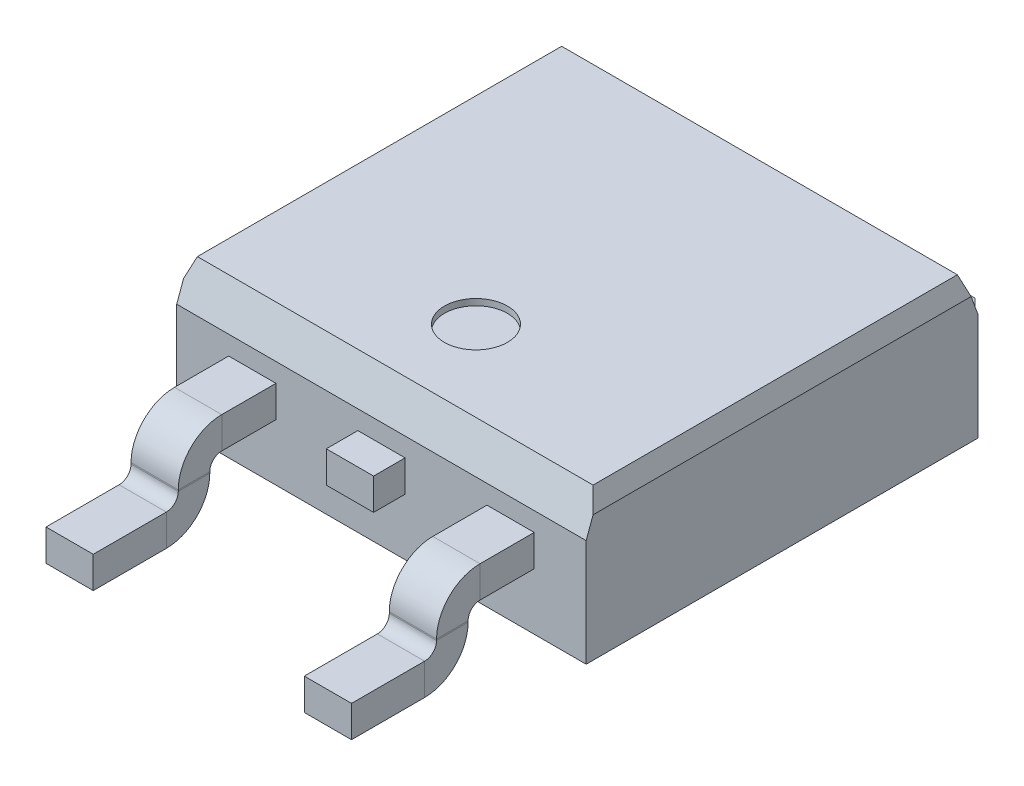
from build123d import *
from OCP.BRepFilletAPI import BRepFilletAPI_MakeChamfer

# Parameters (mm, degrees)
SKETCH1_W           = 6.5
SKETCH1_H           = 6.22
BOSS_EXTRUDE1_DEPTH = 2.3
SKETCH2_R           = 0.5
CUT_EXTRUDE1_DEPTH  = 0.1
SKETCH3_W           = 5.4
SKETCH3_H           = 0.9
BOSS_EXTRUDE2_DEPTH = 1
CHAMFER2_SIZE       = 0.5
SKETCH5_W           = 0.75
SKETCH5_H           = 0.5
SKETCH10_W          = 0.75
SKETCH10_H          = 0.5
BOSS_EXTRUDE3_DEPTH = 0.5
CHAMFER3_SIZE       = 0.6
CHAMFER3_SIZE2      = 0.218382141
CHAMFER4_SIZE       = 0.3
CHAMFER4_SIZE2      = 0.10919107


with BuildPart() as part:
    # Sketch1 → Boss-Extrude1 (new body)
    with BuildSketch(Plane(origin=(0, 0, 0), x_dir=(1, 0, 0), z_dir=(0, 1, 0))):
        with Locations((3.25, 3.11)):
            Rectangle(SKETCH1_W, SKETCH1_H)
    extrude(amount=BOSS_EXTRUDE1_DEPTH)

    # Sketch2 → Cut-Extrude1 (cut)
    with BuildSketch(Plane(origin=(0, 2.3, 0), x_dir=(1, 0, 0), z_dir=(0, 1, 0))):
        with Locations(Location((3.25, 1.5, 0), (0, 0, 270))):
            Circle(SKETCH2_R)
    extrude(amount=-CUT_EXTRUDE1_DEPTH, mode=Mode.SUBTRACT)

    # Sketch3 → Boss-Extrude2 (add)
    with BuildSketch(Plane(origin=(0, 0, -6.22), x_dir=(-1, 0, 0), z_dir=(0, 0, -1))):
        with Locations((-3.25, 0.45)):
            Rectangle(SKETCH3_W, SKETCH3_H)
    extrude(amount=BOSS_EXTRUDE2_DEPTH)

    # Chamfer2
    chamfer2_edges = [part.edges().sort_by_distance(p)[0] for p in [
        (5.95, 0.45, -7.22),
        (0.55, 0.45, -7.22),
    ]]
    chamfer(chamfer2_edges, length=CHAMFER2_SIZE)

    # Sweep2: sweep along a path in Sketch8
    with BuildLine(Plane(origin=(1.2, 0, 0), x_dir=(0, 0, -1), z_dir=(1, 0, 0))) as sweep2_path:
        Line((0, 1.15), (-0.860174932, 1.15))
        ThreePointArc((-0.860174932, 1.15), (-1.171301915, 1.021126984), (-1.300174932, 0.71))
        Line((-1.300174932, 0.71), (-1.300174932, 0.69))
        ThreePointArc((-1.300174932, 0.69), (-1.429047948, 0.378873016), (-1.740174932, 0.25))
        Line((-1.740174932, 0.25), (-2.900174932, 0.25))
    # Sketch5 → Sweep2 (sweep)
    with BuildSketch(Plane.XY):
        with Locations((1.2, 1.15)):
            Rectangle(SKETCH5_W, SKETCH5_H)
        with Locations((5.3, 1.15)):
            Rectangle(SKETCH5_W, SKETCH5_H)
    sweep(path=sweep2_path.line)

    # Sketch10 → Boss-Extrude3 (add)
    with BuildSketch(Plane.XY):
        with Locations((3.25, 1.15)):
            Rectangle(SKETCH10_W, SKETCH10_H)
    extrude(amount=BOSS_EXTRUDE3_DEPTH)

    # Chamfer3: one chamfer whose edges measure the first distance from different faces: ONE call of the kernel's chamfer builder (chamfer() names one face for all edges)
    chamfer3_edges_1 = [part.edges().sort_by_distance(p)[0] for p in [
        (3.25, 2.3, -6.22),
    ]]
    chamfer3_side_1 = [part.faces().sort_by_distance(p)[0] for p in [
        (3.25, 1.48716551, -6.22),
    ]]
    chamfer3_edges_2 = [part.edges().sort_by_distance(p)[0] for p in [
        (3.25, 2.3, 0),
    ]]
    chamfer3_side_2 = [part.faces().sort_by_distance(p)[0] for p in [
        (0.068949257, 1.15, 0),
    ]]
    chamfer3 = BRepFilletAPI_MakeChamfer(part.part.solid().wrapped)
    for e in chamfer3_edges_1:
        chamfer3.Add(CHAMFER3_SIZE, CHAMFER3_SIZE2, e.wrapped, chamfer3_side_1[0].wrapped)  # the first distance lies on this face
    for e in chamfer3_edges_2:
        chamfer3.Add(CHAMFER3_SIZE, CHAMFER3_SIZE2, e.wrapped, chamfer3_side_2[0].wrapped)  # the first distance lies on this face
    add(Compound.cast(chamfer3.Shape()), mode=Mode.REPLACE)

    # Chamfer4: one chamfer whose edges measure the first distance from different faces: ONE call of the kernel's chamfer builder (chamfer() names one face for all edges)
    chamfer4_edges_1 = [part.edges().sort_by_distance(p)[0] for p in [
        (0, 2.3, -3.11),
    ]]
    chamfer4_side_1 = [part.faces().sort_by_distance(p)[0] for p in [
        (0, 1.141218478, -3.11),
    ]]
    chamfer4_edges_2 = [part.edges().sort_by_distance(p)[0] for p in [
        (6.5, 2.3, -3.11),
    ]]
    chamfer4_side_2 = [part.faces().sort_by_distance(p)[0] for p in [
        (6.5, 1.141218478, -3.11),
    ]]
    chamfer4 = BRepFilletAPI_MakeChamfer(part.part.solid().wrapped)
    for e in chamfer4_edges_1:
        chamfer4.Add(CHAMFER4_SIZE, CHAMFER4_SIZE2, e.wrapped, chamfer4_side_1[0].wrapped)  # the first distance lies on this face
    for e in chamfer4_edges_2:
        chamfer4.Add(CHAMFER4_SIZE, CHAMFER4_SIZE2, e.wrapped, chamfer4_side_2[0].wrapped)  # the first distance lies on this face
    add(Compound.cast(chamfer4.Shape()), mode=Mode.REPLACE)


solid = part.part
